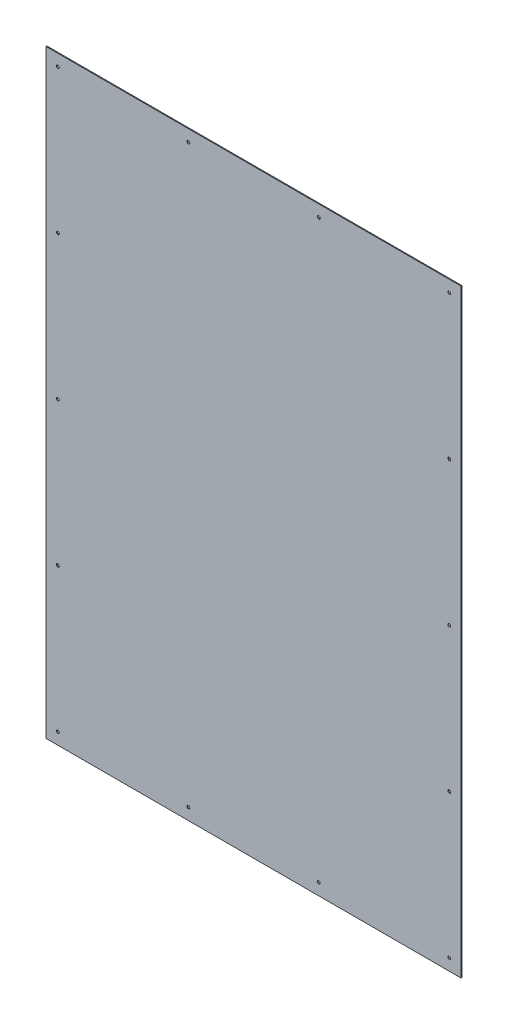
from build123d import *

# Parameters (mm, degrees)
CROQUIS1_W              = 900
CROQUIS1_H              = 1300
SALIENTE_EXTRUIR1_DEPTH = 1.9
CROQUIS2_R              = 3.175
CORTAR_EXTRUIR1_DEPTH   = 10


with BuildPart() as part:
    # Croquis1 → Saliente-Extruir1 (new body)
    with BuildSketch(Plane.XY):
        Rectangle(CROQUIS1_W, CROQUIS1_H)
    extrude(amount=SALIENTE_EXTRUIR1_DEPTH)

    # Croquis2 → Cortar-Extruir1 (cut)
    with BuildSketch(Plane.XY.offset(1.9)):
        with Locations((424.6, 624.6)):
            Circle(CROQUIS2_R)
        with Locations((424.6, -624.6)):
            Circle(CROQUIS2_R)
        with Locations((-424.6, -624.6)):
            Circle(CROQUIS2_R)
        with Locations((-424.6, 624.6)):
            Circle(CROQUIS2_R)
        with Locations((141.54, 624.6)):
            Circle(CROQUIS2_R)
        with Locations((-141.52, 624.6)):
            Circle(CROQUIS2_R)
        with Locations((-141.52, -624.6)):
            Circle(CROQUIS2_R)
        with Locations((141.54, -624.6)):
            Circle(CROQUIS2_R)
        with Locations((424.6, 0)):
            Circle(CROQUIS2_R)
        with Locations((424.6, 312.3)):
            Circle(CROQUIS2_R)
        with Locations((424.6, -312.3)):
            Circle(CROQUIS2_R)
        with Locations((-424.6, -312.3)):
            Circle(CROQUIS2_R)
        with Locations((-424.6, 0)):
            Circle(CROQUIS2_R)
        with Locations((-424.6, 312.3)):
            Circle(CROQUIS2_R)
    extrude(amount=-CORTAR_EXTRUIR1_DEPTH, mode=Mode.SUBTRACT)


solid = part.part
